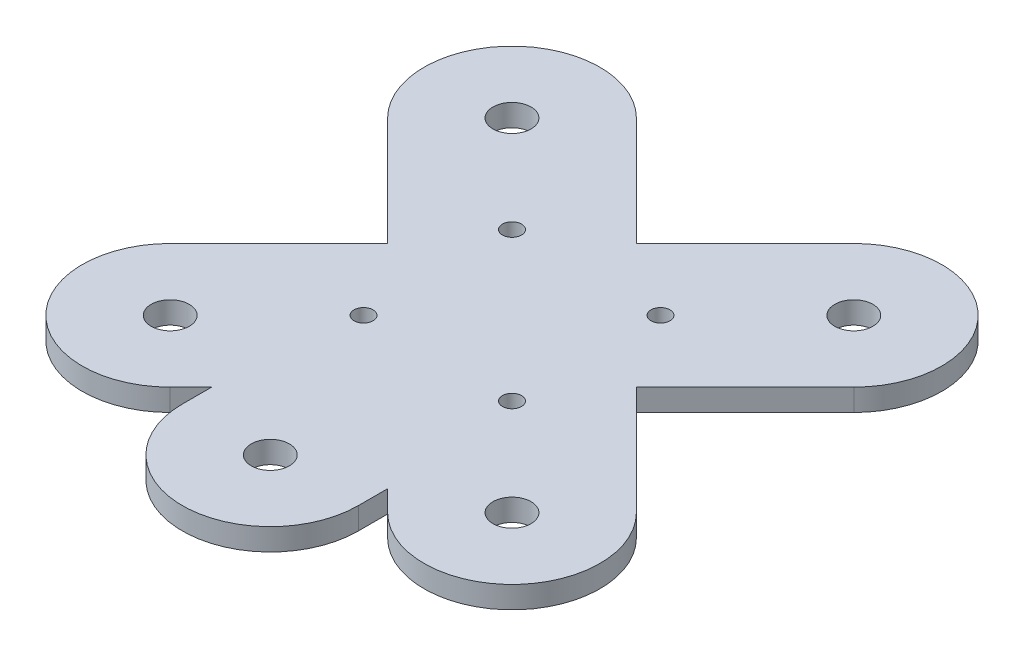
from build123d import *

# Parameters (mm, degrees)
BOSS_EXTRU_1_DEPTH      = 7.5
ENL_V_MAT_EXTRU_1_DEPTH = 2
ESQUISSE5_R             = 3.25
ENL_V_MAT_EXTRU_2_DEPTH = 144.052645944
ESQUISSE7_R             = 6.5
ENL_V_MAT_EXTRU_3_DEPTH = 144.143492733


with BuildPart() as part:
    # Esquisse2 → Boss.-Extru.1 (new body)
    with BuildSketch(Plane(origin=(0, 0, 0), x_dir=(1, 0, 0), z_dir=(0, 1, 0))):
        with BuildLine():
            Line((79.497474683, -37.071067812), (42.426406871, 0))
            Line((42.426406871, 0), (79.497474683, 37.071067812))
            ThreePointArc((79.497474683, 37.071067812), (79.497474683, 79.497474683), (37.071067812, 79.497474683))
            Line((37.071067812, 79.497474683), (0, 42.426406871))
            Line((0, 42.426406871), (-37.071067812, 79.497474683))
            ThreePointArc((-37.071067812, 79.497474683), (-79.497474683, 79.497474683), (-79.497474683, 37.071067812))
            Line((-79.497474683, 37.071067812), (-42.426406871, 0))
            Line((-42.426406871, 0), (-79.497474683, -37.071067812))
            ThreePointArc((-79.497474683, -37.071067812), (-79.497474683, -79.497474683), (-37.071067812, -79.497474683))
            Line((-37.071067812, -79.497474683), (-30, -72.426406871))
            Line((-30, -72.426406871), (-30, -82.426406871))
            ThreePointArc((-30, -82.426406871), (0, -112.426406871), (30, -82.426406871))
            Line((30, -82.426406871), (30, -72.426406871))
            Line((30, -72.426406871), (37.071067812, -79.497474683))
            ThreePointArc((37.071067812, -79.497474683), (79.497474683, -79.497474683), (79.497474683, -37.071067812))
        make_face()
    extrude(amount=BOSS_EXTRU_1_DEPTH)

    # Esquisse4 → Enlèv. mat.-Extru.1 (cut)
    with BuildSketch(Plane(origin=(0, 0, 0), x_dir=(-1, 0, 0), z_dir=(0, -1, 0))):
        with BuildLine():
            Line((-33.535533906, -33.535533906), (-18.245921943, -18.245921943))
            Line((-18.245921943, -18.245921943), (-28.852523661, -7.639320225))
            Line((-28.852523661, -7.639320225), (-46.53019319, -25.316989755))
            ThreePointArc((-46.53019319, -25.316989755), (-39.575984314, -28.703872332), (-33.535533906, -33.535533906))
        make_face()
        with BuildLine():
            Line((-7.639320225, -28.852523661), (-18.245921943, -18.245921943))
            Line((-18.245921943, -18.245921943), (-33.535533906, -33.535533906))
            ThreePointArc((-33.535533906, -33.535533906), (-28.703872332, -39.575984314), (-25.316989755, -46.53019319))
            Line((-25.316989755, -46.53019319), (-7.639320225, -28.852523661))
        make_face()
        with BuildLine():
            ThreePointArc((-46.53019319, 25.316989755), (-33.535533906, 33.535533906), (-25.316989755, 46.53019319))
            Line((-25.316989755, 46.53019319), (-7.639320225, 28.852523661))
            Line((-7.639320225, 28.852523661), (-28.852523661, 7.639320225))
            Line((-28.852523661, 7.639320225), (-46.53019319, 25.316989755))
        make_face()
        with BuildLine():
            ThreePointArc((25.316989755, 46.53019319), (33.535533906, 33.535533906), (46.53019319, 25.316989755))
            Line((46.53019319, 25.316989755), (28.852523661, 7.639320225))
            Line((28.852523661, 7.639320225), (7.639320225, 28.852523661))
            Line((7.639320225, 28.852523661), (25.316989755, 46.53019319))
        make_face()
        with BuildLine():
            ThreePointArc((46.53019319, -25.316989755), (33.535533906, -33.535533906), (25.316989755, -46.53019319))
            Line((25.316989755, -46.53019319), (7.639320225, -28.852523661))
            Line((7.639320225, -28.852523661), (28.852523661, -7.639320225))
            Line((28.852523661, -7.639320225), (46.53019319, -25.316989755))
        make_face()
    extrude(amount=-ENL_V_MAT_EXTRU_1_DEPTH, mode=Mode.SUBTRACT)

    # Esquisse5 → Enlèv. mat.-Extru.2 (cut, through all)
    with BuildSketch(Plane(origin=(0, 2, 0), x_dir=(-1, 0, 0), z_dir=(0, -1, 0))):
        with Locations(Location((-25.316989755, -25.316989755, 0), (0, 0, 90))):
            Circle(ESQUISSE5_R)
        with Locations(Location((-25.316989755, 25.316989755, 0), (0, 0, 90))):
            Circle(ESQUISSE5_R)
        with Locations(Location((25.316989755, 25.316989755, 0), (0, 0, 90))):
            Circle(ESQUISSE5_R)
        with Locations(Location((25.316989755, -25.316989755, 0), (0, 0, 90))):
            Circle(ESQUISSE5_R)
    extrude(amount=-ENL_V_MAT_EXTRU_2_DEPTH, mode=Mode.SUBTRACT)

    # Esquisse7 → Enlèv. mat.-Extru.3 (cut, through all)
    with BuildSketch(Plane(origin=(0, 0, 0), x_dir=(-1, 0, 0), z_dir=(0, -1, 0))):
        with Locations(Location((0, -82.426406871, 0), (0, 0, 90))):
            Circle(ESQUISSE7_R)
        with Locations(Location((-58.284271247, -58.284271247, 0), (0, 0, 90))):
            Circle(ESQUISSE7_R)
        with Locations(Location((-58.284271247, 58.284271247, 0), (0, 0, 90))):
            Circle(ESQUISSE7_R)
        with Locations(Location((58.284271247, 58.284271247, 0), (0, 0, 90))):
            Circle(ESQUISSE7_R)
        with Locations(Location((58.284271247, -58.284271247, 0), (0, 0, 90))):
            Circle(ESQUISSE7_R)
    extrude(amount=-ENL_V_MAT_EXTRU_3_DEPTH, mode=Mode.SUBTRACT)


solid = part.part
